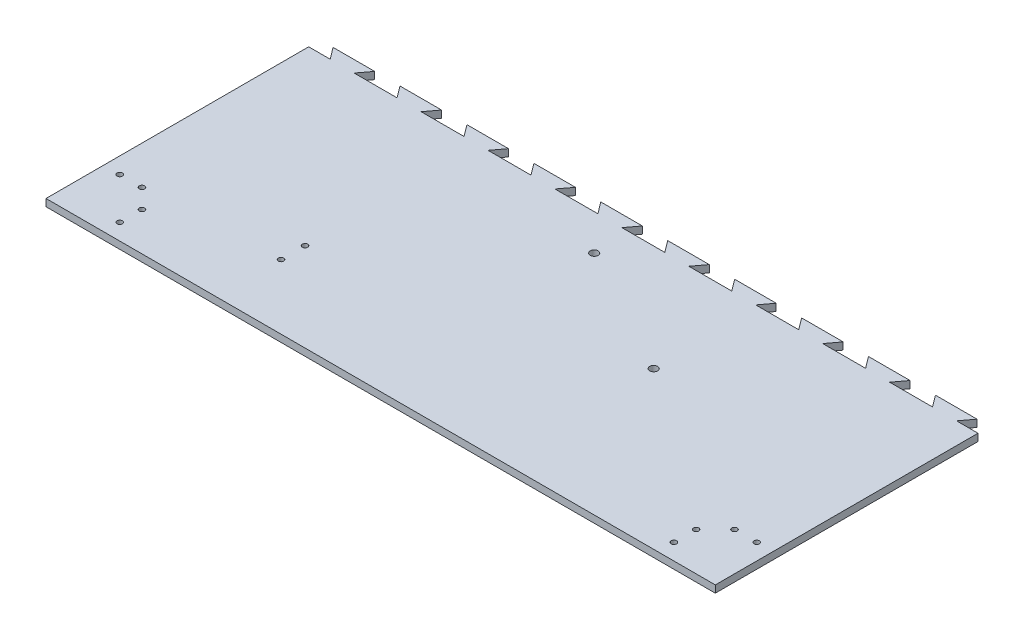
from build123d import *

# Parameters (mm, degrees)
SCHIZZO1_W                   = 558
SCHIZZO1_H                   = 438
ESTRUSIONE_ESTRUSIONE1_DEPTH = 6
SCHIZZO2_R                   = 2.25
TAGLIO_ESTRUSIONE1_DEPTH     = 10
SCHIZZO4_R                   = 3.3
TAGLIO_ESTRUSIONE2_DEPTH     = 10
SCHIZZO5_R                   = 2.25
TAGLIO_ESTRUSIONE3_DEPTH     = 10
TAGLIO_ESTRUSIONE4_DEPTH     = 10


with BuildPart() as part:
    # Schizzo1 → Estrusione-Estrusione1 (new body)
    with BuildSketch(Plane(origin=(0, 0, 0), x_dir=(1, 0, 0), z_dir=(0, 1, 0))):
        Rectangle(SCHIZZO1_W, SCHIZZO1_H)
    extrude(amount=ESTRUSIONE_ESTRUSIONE1_DEPTH)

    # Schizzo2 → Taglio-Estrusione1 (cut)
    with BuildSketch(Plane(origin=(0, 6, 0), x_dir=(1, 0, 0), z_dir=(0, 1, 0))):
        with Locations(Location((-231, 205.5, 0), (0, 0, 270))):
            Circle(SCHIZZO2_R)
        with Locations(Location((-231, 187, 0), (0, 0, 270))):
            Circle(SCHIZZO2_R)
        with Locations(Location((-247, 171, 0), (0, 0, 270))):
            Circle(SCHIZZO2_R)
        with Locations(Location((-265.5, 171, 0), (0, 0, 270))):
            Circle(SCHIZZO2_R)
        with Locations(Location((231, 205.5, 0), (0, 0, 270))):
            Circle(SCHIZZO2_R)
        with Locations(Location((231, 187, 0), (0, 0, 270))):
            Circle(SCHIZZO2_R)
        with Locations(Location((247, 171, 0), (0, 0, 270))):
            Circle(SCHIZZO2_R)
        with Locations(Location((265.5, 171, 0), (0, 0, 270))):
            Circle(SCHIZZO2_R)
        with Locations(Location((265.5, -171, 0), (0, 0, 270))):
            Circle(SCHIZZO2_R)
        with Locations(Location((247, -171, 0), (0, 0, 270))):
            Circle(SCHIZZO2_R)
        with Locations(Location((231, -187, 0), (0, 0, 270))):
            Circle(SCHIZZO2_R)
        with Locations(Location((231, -205.5, 0), (0, 0, 270))):
            Circle(SCHIZZO2_R)
        with Locations(Location((-231, -205.5, 0), (0, 0, 270))):
            Circle(SCHIZZO2_R)
        with Locations(Location((-231, -187, 0), (0, 0, 270))):
            Circle(SCHIZZO2_R)
        with Locations(Location((-247, -171, 0), (0, 0, 270))):
            Circle(SCHIZZO2_R)
        with Locations(Location((-265.5, -171, 0), (0, 0, 270))):
            Circle(SCHIZZO2_R)
    extrude(amount=-TAGLIO_ESTRUSIONE1_DEPTH, mode=Mode.SUBTRACT)

    # Schizzo4 → Taglio-Estrusione2 (cut)
    with BuildSketch(Plane(origin=(0, 6, 0), x_dir=(1, 0, 0), z_dir=(0, 1, 0))):
        with Locations(Location((-11.04713937, -29.950902322, 0), (0, 0, 270))):
            Circle(SCHIZZO4_R)
        with Locations(Location((97.170402481, -88.545989873, 0), (0, 0, 270))):
            Circle(SCHIZZO4_R)
        with Locations(Location((155.765489817, 19.671552094, 0), (0, 0, 270))):
            Circle(SCHIZZO4_R)
        with Locations(Location((47.547947967, 78.266639645, 0), (0, 0, 270))):
            Circle(SCHIZZO4_R)
    extrude(amount=-TAGLIO_ESTRUSIONE2_DEPTH, mode=Mode.SUBTRACT)

    # Schizzo5 → Taglio-Estrusione3 (cut)
    with BuildSketch(Plane.XZ):
        with Locations(Location((-136.921607377, 165.135242981, 0), (0, 0, 270))):
            Circle(SCHIZZO5_R)
        with Locations(Location((-136.921607377, 145.135242981, 0), (0, 0, 270))):
            Circle(SCHIZZO5_R)
    extrude(amount=-TAGLIO_ESTRUSIONE3_DEPTH, mode=Mode.SUBTRACT)

    # Schizzo6 → Taglio-Estrusione4 (cut)
    with BuildSketch(Plane(origin=(0, 6, 0), x_dir=(1, 0, 0), z_dir=(0, 1, 0))):
        Polygon((-279, 0), (-261.1, 0), (-268.4125, 9.75), (-233.7875, 9.75), (-241.1, 0), (-223.2, 0), (-205.3, 0), (-212.6125, 9.75), (-177.9875, 9.75), (-185.3, 0), (-167.4, 0), (-149.5, 0), (-156.8125, 9.75), (-122.1875, 9.75), (-129.5, 0), (-111.6, 0), (-93.7, 0), (-101.0125, 9.75), (-66.3875, 9.75), (-73.7, 0), (-55.8, 0), (-37.9, 0), (-45.2125, 9.75), (-10.5875, 9.75), (-17.9, 0), (0, 0), (17.9, 0), (10.5875, 9.75), (45.2125, 9.75), (37.9, 0), (55.8, 0), (73.7, 0), (66.3875, 9.75), (101.0125, 9.75), (93.7, 0), (111.6, 0), (129.5, 0), (122.1875, 9.75), (156.8125, 9.75), (149.5, 0), (167.4, 0), (185.3, 0), (177.9875, 9.75), (212.6125, 9.75), (205.3, 0), (223.2, 0), (241.1, 0), (233.7875, 9.75), (268.4125, 9.75), (261.1, 0), (279, 0), (279, 219), (-279, 219), align=None)
    extrude(amount=-TAGLIO_ESTRUSIONE4_DEPTH, mode=Mode.SUBTRACT)


solid = part.part
